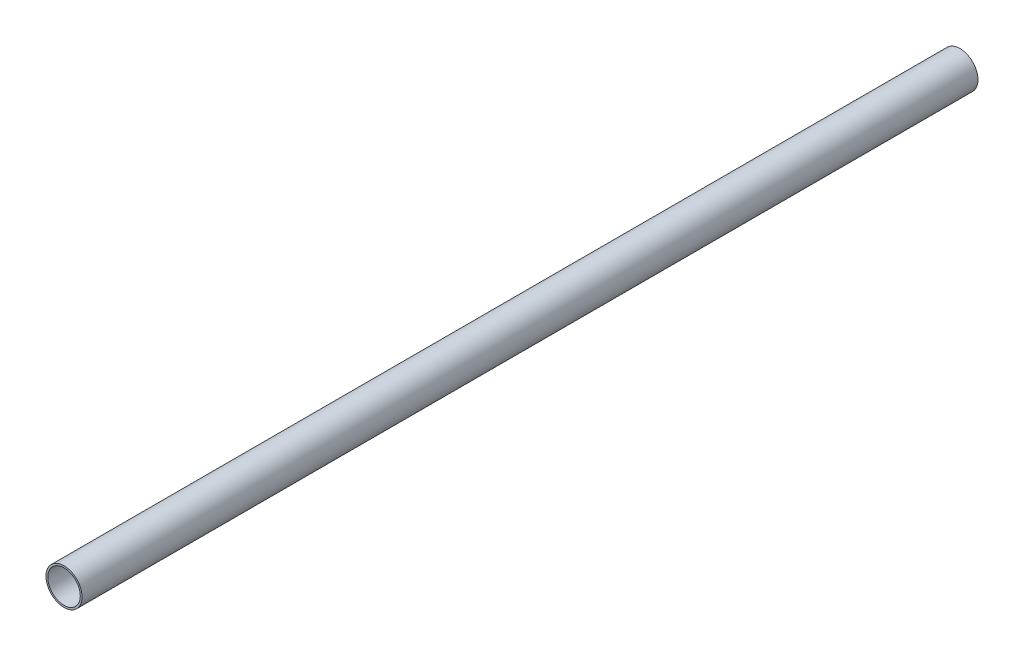
from build123d import *

# Parameters (mm, degrees)
SKETCH1_R           = 10
SKETCH1_R_2         = 9
BOSS_EXTRUDE1_DEPTH = 496


with BuildPart() as part:
    # Sketch1 → Boss-Extrude1 (new body)
    with BuildSketch(Plane.XY):
        Circle(SKETCH1_R)
        Circle(SKETCH1_R_2, mode=Mode.SUBTRACT)
    extrude(amount=BOSS_EXTRUDE1_DEPTH)


solid = part.part
